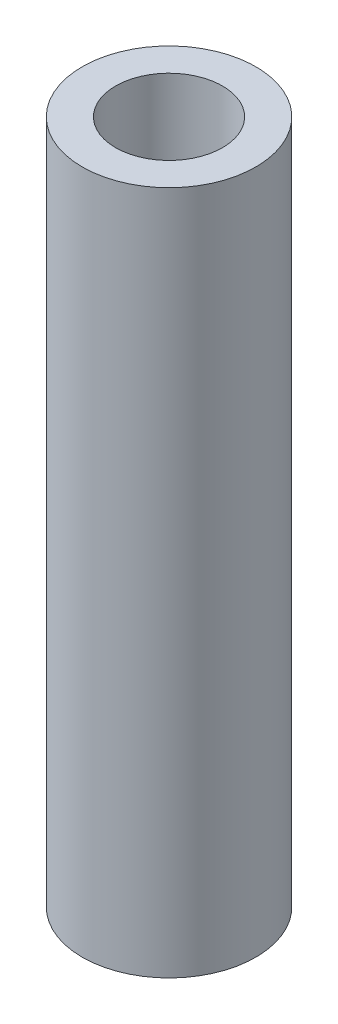
from build123d import *

# Parameters (mm, degrees)
SKETCH1_R           = 2.577786199
SKETCH1_R_2         = 1.5875
BOSS_EXTRUDE1_DEPTH = 20.32


with BuildPart() as part:
    # Sketch1 → Boss-Extrude1 (new body)
    with BuildSketch(Plane(origin=(0, 0, 0), x_dir=(1, 0, 0), z_dir=(0, 1, 0))):
        with Locations(Location((0, 0, 0), (0, 0, 270))):
            Circle(SKETCH1_R)
        with Locations(Location((0, 0, 0), (0, 0, 270))):
            Circle(SKETCH1_R_2, mode=Mode.SUBTRACT)
    extrude(amount=BOSS_EXTRUDE1_DEPTH)


solid = part.part
